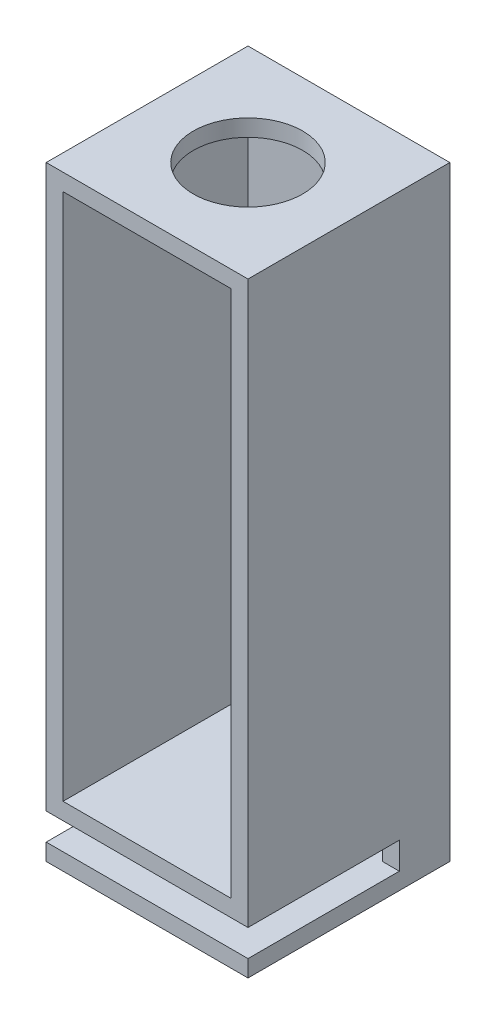
from build123d import *

# Parameters (mm, degrees)
CROQUIS1_W                 = 12
CROQUIS1_H                 = 12
SALIENTE_EXTRUIR1_DEPTH    = 36
VACIADO1_T                 = -1
CORTAR_EXTRUIR1_DEPTH      = 37.986484018
CORTAR_EXTRUIR1_DEPTH_BACK = 3
CROQUIS2_R                 = 3.25
CROQUIS3_W                 = 13.652855543
CROQUIS3_H                 = 1.6
CORTAR_EXTRUIR2_DEPTH      = 9
CROQUIS4_W                 = 10
CROQUIS4_H                 = 1
SALIENTE_EXTRUIR2_DEPTH    = 11


with BuildPart() as part:
    # Croquis1 → Saliente-Extruir1 (new body)
    with BuildSketch(Plane(origin=(0, 0, 0), x_dir=(1, 0, 0), z_dir=(0, 1, 0))):
        Rectangle(CROQUIS1_W, CROQUIS1_H)
    extrude(amount=SALIENTE_EXTRUIR1_DEPTH)

    # Vaciado1
    vaciado1_openings = [part.faces().sort_by_distance(p)[0] for p in [
        (0, 18, 6),
    ]]
    offset(amount=VACIADO1_T, openings=vaciado1_openings, kind=Kind.INTERSECTION)

    # Croquis2 → Cortar-Extruir1 (cut, two sides: drawn at the far end of the back side and taken through both)
    with BuildSketch(Plane(origin=(0, 36, 0), x_dir=(1, 0, 0), z_dir=(0, 1, 0)).offset(-CORTAR_EXTRUIR1_DEPTH_BACK)):
        with Locations(Location((0, 0, 0), (0, 0, 90))):
            Circle(CROQUIS2_R)
    extrude(amount=CORTAR_EXTRUIR1_DEPTH + CORTAR_EXTRUIR1_DEPTH_BACK, mode=Mode.SUBTRACT)

    # Croquis3 → Cortar-Extruir2 (cut)
    with BuildSketch(Plane.XY.offset(6)):
        with Locations((0.0537514, 1.8)):
            Rectangle(CROQUIS3_W, CROQUIS3_H)
    extrude(amount=-CORTAR_EXTRUIR2_DEPTH, mode=Mode.SUBTRACT)

    # Croquis4 → Saliente-Extruir2 (add)
    with BuildSketch(Plane.XY.offset(6)):
        with Locations((0, 3.1)):
            Rectangle(CROQUIS4_W, CROQUIS4_H)
    extrude(amount=-SALIENTE_EXTRUIR2_DEPTH)


solid = part.part
